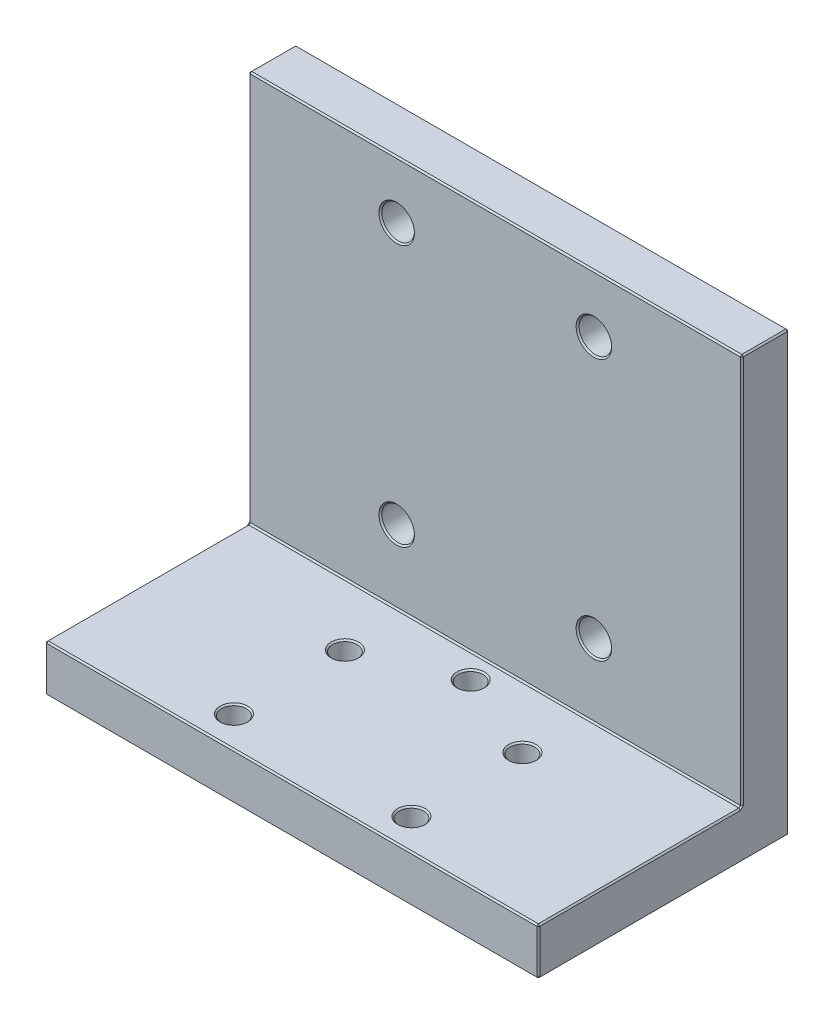
from build123d import *

# Parameters (mm, degrees)
BOSS_EXTRUDE1_DEPTH = 50
SKETCH2_R           = 3.3
CUT_EXTRUDE1_DEPTH  = 100
SKETCH3_R           = 2.5
CUT_EXTRUDE2_DEPTH  = 100
CHAMFER1_SIZE       = 0.3


with BuildPart() as part:
    # Sketch1 → Boss-Extrude1 (new, symmetric)
    with BuildSketch(Plane(origin=(0, 0, 0), x_dir=(0, 0, -1), z_dir=(1, 0, 0))):
        Polygon((0, 0), (0, 88.9), (-9.525, 88.9), (-9.525, 9.525), (-50.8, 9.525), (-50.8, 0), align=None)
    extrude(amount=BOSS_EXTRUDE1_DEPTH, both=True)

    # Sketch2 → Cut-Extrude1 (cut)
    with BuildSketch(Plane.XY.offset(9.525)):
        with Locations((-20, 77.3)):
            Circle(SKETCH2_R)
        with Locations((20, 77.3)):
            Circle(SKETCH2_R)
        with Locations((20, 24.3)):
            Circle(SKETCH2_R)
        with Locations((-20, 24.3)):
            Circle(SKETCH2_R)
    extrude(amount=-CUT_EXTRUDE1_DEPTH, mode=Mode.SUBTRACT)

    # Sketch3 → Cut-Extrude2 (cut)
    with BuildSketch(Plane(origin=(0, 9.525, 0), x_dir=(1, 0, 0), z_dir=(0, 1, 0))):
        with Locations(Location((-18, -22.025, 0), (0, 0, 270))):
            Circle(SKETCH3_R)
        with Locations(Location((-18, -44.525, 0), (0, 0, 270))):
            Circle(SKETCH3_R)
        with Locations(Location((18, -44.525, 0), (0, 0, 270))):
            Circle(SKETCH3_R)
        with Locations(Location((18, -22.025, 0), (0, 0, 270))):
            Circle(SKETCH3_R)
        with Locations(Location((0, -14.525, 0), (0, 0, 270))):
            Circle(SKETCH3_R)
    extrude(amount=-CUT_EXTRUDE2_DEPTH, mode=Mode.SUBTRACT)

    # Chamfer1
    chamfer1_edges = [part.edges().sort_by_distance(p)[0] for p in [
        (50, 88.9, 4.7625),
        (0, 0, 50.8),
        (0, 9.525, 50.8),
        (0, 9.525, 9.525),
        (0, 88.9, 9.525),
        (0, 88.9, 0),
        (0, 0, 0),
        (50, 49.2125, 9.525),
        (50, 9.525, 30.1625),
        (50, 4.7625, 50.8),
        (-23.3, 77.3, 0),
        (-23.3, 77.3, 9.525),
        (16.7, 77.3, 0),
        (16.7, 77.3, 9.525),
        (16.7, 24.3, 0),
        (16.7, 24.3, 9.525),
        (-23.3, 24.3, 0),
        (-23.3, 24.3, 9.525),
        (-18, 0, 19.525),
        (50, 0, 25.4),
        (-18, 9.525, 19.525),
        (-18, 0, 42.025),
        (-18, 9.525, 42.025),
        (18, 0, 42.025),
        (18, 9.525, 42.025),
        (18, 0, 19.525),
        (18, 9.525, 19.525),
        (0, 0, 12.025),
        (0, 9.525, 12.025),
        (-50, 4.7625, 50.8),
        (-50, 9.525, 30.1625),
        (-50, 49.2125, 9.525),
        (50, 44.45, 0),
        (-50, 88.9, 4.7625),
        (-50, 44.45, 0),
        (-50, 0, 25.4),
    ]]
    chamfer(chamfer1_edges, length=CHAMFER1_SIZE)


solid = part.part
